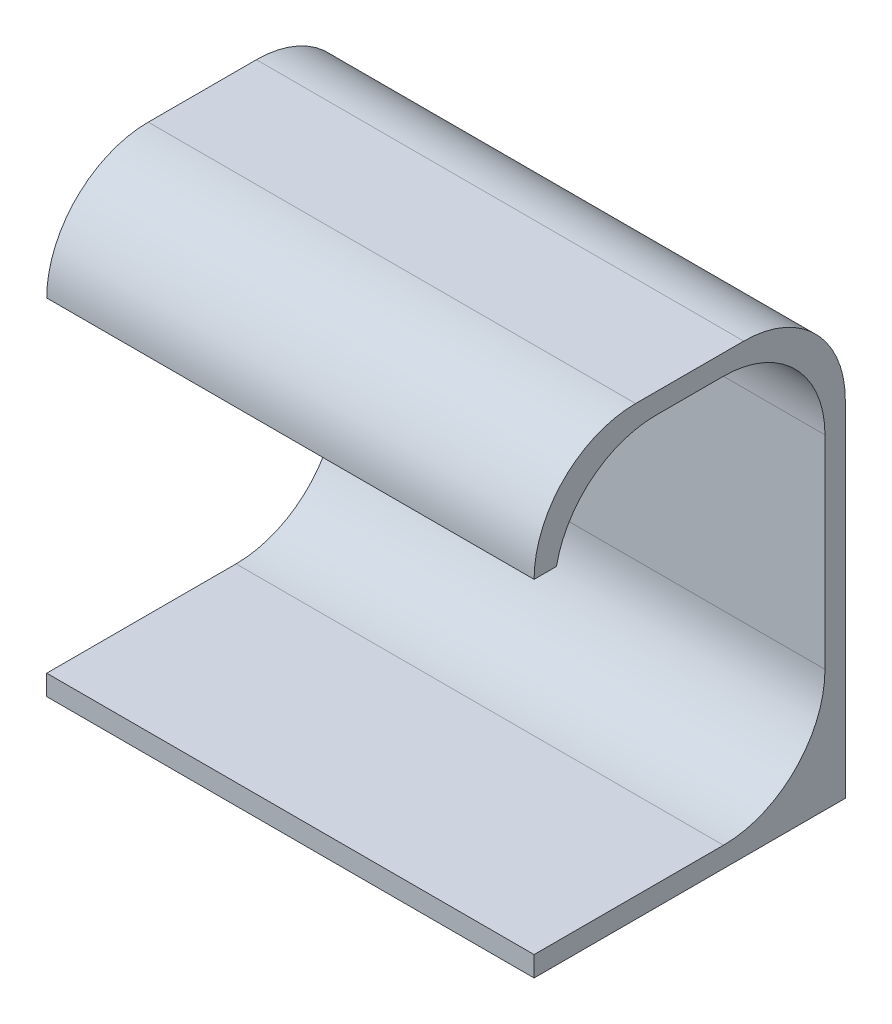
from build123d import *

# Parameters (mm, degrees)
BOSS_EXTRUDE3_DEPTH = 48
CUT_EXTRUDE2_DEPTH  = 54


with BuildPart() as part:
    # Sketch3 → Boss-Extrude3 (new body)
    with BuildSketch(Plane(origin=(0, 0, 0), x_dir=(0, 0, -1), z_dir=(1, 0, 0))):
        with BuildLine():
            Line((7.25, -20.3), (7.25, -11.034312351))
            Line((7.25, -11.034312351), (7.25, -2))
            ThreePointArc((7.25, -2), (10.178932188, 5.071067812), (17.25, 8))
            Line((17.25, 8), (27.9, 8))
            ThreePointArc((27.9, 8), (34.971067812, 5.071067812), (37.9, -2))
            Line((37.9, -2), (37.9, -20.3))
            Line((37.9, -20.3), (37.9, -36))
            Line((37.9, -36), (7.25, -36))
            Line((7.25, -36), (7.25, -20.3))
        make_face()
        with BuildLine():
            Line((9.25, -20.3), (9.25, -11.034312351))
            Line((9.25, -11.034312351), (9.25, -4))
            ThreePointArc((9.25, -4), (12.178932188, 3.071067812), (19.25, 6))
            Line((19.25, 6), (25.9, 6))
            ThreePointArc((25.9, 6), (32.971067812, 3.071067812), (35.9, -4))
            Line((35.9, -4), (35.9, -20.3))
            Line((35.9, -20.3), (35.9, -24))
            ThreePointArc((35.9, -24), (32.971067812, -31.071067812), (25.9, -34))
            Line((25.9, -34), (9.25, -34))
            Line((9.25, -34), (9.25, -20.3))
        make_face(mode=Mode.SUBTRACT)
    extrude(amount=BOSS_EXTRUDE3_DEPTH)

    # Sketch4 → Cut-Extrude2 (cut)
    with BuildSketch(Plane.ZY):
        Polygon((-9.25, -34), (-7.25, -34), (-7.25, -2), (-9.452041029, -2), align=None)
    extrude(amount=-CUT_EXTRUDE2_DEPTH, mode=Mode.SUBTRACT)


solid = part.part
